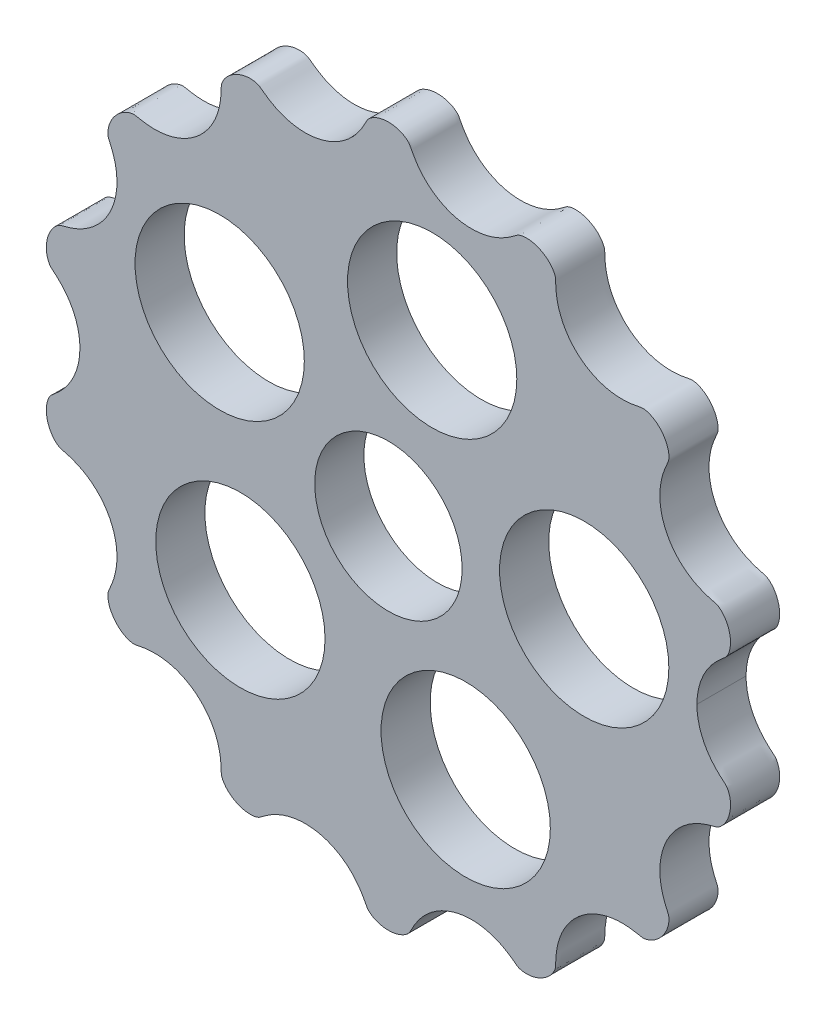
from build123d import *

# Parameters (mm, degrees)
BOSS_EXTRUDE1_DEPTH     = 5
CUT_EXTRUDE1_DEPTH      = 51.047009351
CUT_EXTRUDE1_DEPTH_BACK = 51.047009351
SKETCH2_R               = 7.5
SKETCH2_R_2             = 8.6125


with BuildPart() as part:
    # Sketch1 → Boss-Extrude1 (new body)
    with BuildSketch(Plane.XY):
        with BuildLine():
            add(Edge.make_bspline(
                [(31.387500001, 0), (31.387500026, -0.191409838), (31.4015889, -0.558999959), (31.462455208, -1.100471271), (31.620339292, -1.804284747), (31.845837979, -2.471145024), (32.138779592, -3.108930329), (32.494092859, -3.710123145), (32.85485867, -4.199914122), (33.196385391, -4.592065917), (33.481395932, -4.881104094), (33.695349877, -5.081930359), (33.873225969, -5.238846703), (34.010820911, -5.356420738), (34.126100817, -5.453563579), (34.218425357, -5.531274661), (34.321370208, -5.622243472), (34.42248528, -5.738555326), (34.526616142, -5.906653236), (34.628243434, -6.124456822), (34.743621811, -6.475137865), (34.822511835, -6.967474085), (34.811254499, -7.56440223), (34.660998274, -8.241656976), (34.42181242, -8.783732333), (34.15025528, -9.191239746), (33.902923393, -9.461924188), (33.718729162, -9.622062791), (33.539449435, -9.74564616), (33.366873711, -9.828511831), (33.18234787, -9.874959474), (33.000369496, -9.922220448), (32.78196544, -9.979321762), (32.529245694, -10.0512452), (32.243345991, -10.142503849), (31.926771107, -10.2588661), (31.537678913, -10.4222942), (31.083527423, -10.647638252), (30.574239611, -10.954067456), (30.028205463, -11.361714103), (29.524217307, -11.824126145), (29.068369731, -12.337466635), (28.670673331, -12.890470325), (28.333939537, -13.476344796), (28.059782265, -14.088772826), (27.849481201, -14.720995747), (27.703410562, -15.370288175), (27.622603934, -16.030098639), (27.607228393, -16.691306548), (27.649814276, -17.265897453), (27.72521961, -17.75248288), (27.8130852, -18.152536765), (27.898270531, -18.469924762), (27.997936462, -18.783869537), (28.11116386, -19.094030204), (28.219559393, -19.357776059), (28.31618286, -19.577676182), (28.388632047, -19.738423638), (28.434726769, -19.841332637), (28.476851504, -19.945926514), (28.5139803, -20.063213574), (28.537245609, -20.214070975), (28.545988815, -20.421106535), (28.528667796, -20.664305086), (28.479281495, -20.93847541), (28.390375736, -21.239018765), (28.236129182, -21.613261831), (27.989390246, -22.039715879), (27.629125422, -22.484235413), (27.198981399, -22.848547171), (26.794373417, -23.090233795), (26.465307873, -23.22576242), (26.233368303, -23.29274082), (26.038842986, -23.325696046), (25.885474252, -23.334363641), (25.749412223, -23.320751217), (25.631198181, -23.298729971), (25.503504803, -23.273017081), (25.365815252, -23.245742636), (25.17842045, -23.209936912), (24.861580666, -23.15540063), (24.425008243, -23.099280725), (23.866879398, -23.06737406), (23.227732011, -23.088381827), (22.593283028, -23.168329088), (21.965427998, -23.308478254), (21.350218497, -23.509248355), (20.756629467, -23.768742639), (20.190411742, -24.084901658), (19.647470301, -24.461409283), (19.135282862, -24.89801354), (18.661137869, -25.394205143), (18.233371948, -25.9476682), (17.866637437, -26.540967012), (17.563997358, -27.167132297), (17.327808384, -27.817980766), (17.179598909, -28.402901182), (17.093470388, -28.911646506), (17.050866719, -29.308158899), (17.030864745, -29.590379325), (17.020190406, -29.843097462), (17.014689565, -30.023995062), (17.011815027, -30.163298232), (17.006262447, -30.274671826), (16.99728203, -30.377172777), (16.9692524, -30.510707375), (16.901063213, -30.694922243), (16.79131022, -30.910274348), (16.586800886, -31.216765334), (16.250514568, -31.581105114), (15.776234534, -31.941308929), (15.151789594, -32.243596243), (14.5766757, -32.392171865), (14.08546615, -32.431000582), (13.71894414, -32.403056699), (13.480348036, -32.356853666), (13.294179223, -32.297748008), (13.161187597, -32.234718317), (13.056974688, -32.166085726), (12.974296484, -32.105122334), (12.871971929, -32.027775268), (12.749006525, -31.935279651), (12.577291705, -31.808567208), (12.354010571, -31.651756231), (12.025699359, -31.437867576), (11.581394178, -31.184384716), (11.040417636, -30.930285317), (10.394168199, -30.701278437), (9.725494629, -30.53787156), (8.869598237, -30.419503121), (7.847967181, -30.41972467), (6.847316751, -30.590852524), (5.900714747, -30.922312194), (5.171539786, -31.290180513), (4.619855424, -31.639804258), (4.106739862, -32.039439551), (3.636092532, -32.484307884), (3.263184555, -32.909891154), (2.973001969, -33.296991095), (2.750469117, -33.633117755), (2.604558982, -33.874823284), (2.486102146, -34.085791845), (2.394242445, -34.257795933), (2.325823796, -34.389053574), (2.261066792, -34.514691353), (2.199326494, -34.634590318), (2.12371547, -34.761953055), (2.018885858, -34.88485401), (1.87028718, -35.020455872), (1.674923004, -35.161740103), (1.434956768, -35.297359465), (1.150119762, -35.419334231), (0.769460402, -35.537430033), (0.286766304, -35.619545885), (-0.204612648, -35.625338884), (-0.690683106, -35.554699369), (-1.077585826, -35.444910287), (-1.368129192, -35.329321198), (-1.613869484, -35.198992053), (-1.816088644, -35.062763588), (-1.970779193, -34.931010646), (-2.084032621, -34.813065531), (-2.159333408, -34.703851232), (-2.20905324, -34.614659613), (-2.256431386, -34.524252201), (-2.305956612, -34.427505552), (-2.366847605, -34.30999054), (-2.4587882, -34.13598509), (-2.576984294, -33.922308749), (-2.722647994, -33.67740764), (-2.945018955, -33.336509028), (-3.235549855, -32.943659747), (-3.609341716, -32.511914186), (-4.081749968, -32.060730677), (-4.597449485, -31.655389431), (-5.152453816, -31.300775561), (-5.887288163, -30.927417187), (-6.839439977, -30.59230849), (-7.844773855, -30.419725507), (-8.869598364, -30.419502966), (-9.725494876, -30.537871549), (-10.394168372, -30.70127833), (-11.040417864, -30.93028527), (-11.58139437, -31.184384621), (-12.025699577, -31.437867507), (-12.354010777, -31.651756143), (-12.57729192, -31.808567128), (-12.749006736, -31.935279565), (-12.871972142, -32.027775183), (-12.974296698, -32.105122247), (-13.056974901, -32.16608564), (-13.161187811, -32.23471823), (-13.294179437, -32.29774792), (-13.480348251, -32.356853576), (-13.718944355, -32.403056607), (-14.085466365, -32.431000489), (-14.576675916, -32.392171768), (-15.151789808, -32.243596142), (-15.776234746, -31.941308824), (-16.250514778, -31.581105006), (-16.586801094, -31.216765224), (-16.791310426, -30.910274237), (-16.901063417, -30.694922131), (-16.969252603, -30.510707262), (-16.997282232, -30.377172664), (-17.006262648, -30.274671713), (-17.011815228, -30.163298119), (-17.014689764, -30.023994949), (-17.020190605, -29.843097349), (-17.030864942, -29.590379211), (-17.050866914, -29.308158787), (-17.09347058, -28.911646391), (-17.179599098, -28.40290107), (-17.327808569, -27.817980647), (-17.563997539, -27.167132186), (-17.866637613, -26.540966885), (-18.23337212, -25.947668091), (-18.661138039, -25.394204998), (-19.135283025, -24.898013447), (-19.647470468, -24.461409096), (-20.190411896, -24.084901617), (-20.756629635, -23.768742344), (-21.350218637, -23.509248474), (-21.96542818, -23.308477669), (-22.593283134, -23.16832969), (-23.227732251, -23.088380303), (-23.866879784, -23.067372181), (-24.425008298, -23.0992813), (-24.861580739, -23.155401751), (-25.17842063, -23.209936331), (-25.365815398, -23.2457426), (-25.503504959, -23.273016895), (-25.631198336, -23.298729796), (-25.749412378, -23.320751047), (-25.885474407, -23.334363469), (-26.038843141, -23.325695873), (-26.233368458, -23.292740646), (-26.465308027, -23.225762244), (-26.794373571, -23.090233617), (-27.198981551, -22.84854699), (-27.629125571, -22.484235229), (-27.989390393, -22.039715693), (-28.236129326, -21.613261644), (-28.390375878, -21.239018577), (-28.479281634, -20.93847522), (-28.528667934, -20.664304896), (-28.545988951, -20.421106346), (-28.537245744, -20.214070785), (-28.513980433, -20.063213384), (-28.476851636, -19.945926324), (-28.4347269, -19.841332448), (-28.388632178, -19.73842345), (-28.31618299, -19.577675994), (-28.219559522, -19.357775871), (-28.111163987, -19.094030017), (-27.997936587, -18.783869351), (-27.898270653, -18.469924576), (-27.813085321, -18.15253658), (-27.725219728, -17.752482696), (-27.649814391, -17.265897269), (-27.607228504, -16.691306364), (-27.62260404, -16.030098455), (-27.703410664, -15.370287991), (-27.849481299, -14.720995562), (-28.059782359, -14.088772639), (-28.333939626, -13.476344608), (-28.670673417, -12.890470134), (-29.068369813, -12.337466442), (-29.524217386, -11.824125949), (-30.028205539, -11.361713904), (-30.574239684, -10.954067253), (-31.083527494, -10.647638045), (-31.537678982, -10.42229399), (-31.926771175, -10.258865888), (-32.243346059, -10.142503635), (-32.529245761, -10.051244984), (-32.781965507, -9.979321544), (-33.000369562, -9.922220228), (-33.182347935, -9.874959254), (-33.366873776, -9.828511609), (-33.5394495, -9.745645937), (-33.718729226, -9.622062567), (-33.902923455, -9.461923963), (-34.150255341, -9.191239519), (-34.421812479, -8.783732104), (-34.660998329, -8.241656745), (-34.81125455, -7.564401999), (-34.822511882, -6.967473853), (-34.743621854, -6.475137634), (-34.628243474, -6.124456592), (-34.526616181, -5.906653006), (-34.422485319, -5.738555098), (-34.321370245, -5.622243244), (-34.218425394, -5.531274433), (-34.126100854, -5.453563352), (-34.010820946, -5.356420512), (-33.873226004, -5.238846477), (-33.695349911, -5.081930135), (-33.481395964, -4.881103871), (-33.196385422, -4.592065696), (-32.854858698, -4.199913904), (-32.494092884, -3.710122929), (-32.138779613, -3.108930115), (-31.845837996, -2.471144813), (-31.558911714, -1.622626634), (-31.427525083, -0.911371145), (-31.387500063, -0.367589804), (-31.387500001, 0)],
                knots=[0.103459311, 0.103459311, 0.103459311, 0.103459311, 0.103459311, 0.108282381, 0.112721697, 0.117161213, 0.121600728, 0.125987713, 0.130374698, 0.13472717, 0.136903406, 0.139079642, 0.14059969, 0.142119739, 0.142879763, 0.143639788, 0.144399812, 0.145159837, 0.146335778, 0.147511719, 0.149360116, 0.151208513, 0.155610339, 0.160013805, 0.164294975, 0.168579928, 0.170438328, 0.172296728, 0.173508946, 0.174721165, 0.175908015, 0.177094865, 0.178281716, 0.179468566, 0.181592661, 0.183716756, 0.185840851, 0.187964946, 0.192222657, 0.196480367, 0.200793288, 0.20510621, 0.209427538, 0.213748866, 0.217926621, 0.222104375, 0.22630704, 0.230509705, 0.23466829, 0.238826875, 0.242945784, 0.245005239, 0.247064694, 0.249143974, 0.251223255, 0.253302535, 0.255381816, 0.256328153, 0.25727449, 0.257747659, 0.258220828, 0.259167165, 0.260371245, 0.261575325, 0.263435854, 0.265296383, 0.267377025, 0.269457666, 0.273617251, 0.277665028, 0.281712441, 0.283576659, 0.285440877, 0.286611911, 0.287782945, 0.288539492, 0.289296038, 0.290052585, 0.290809131, 0.291821706, 0.29283428, 0.294859428, 0.298909724, 0.302906114, 0.306902505, 0.310950904, 0.314999303, 0.319091512, 0.323183722, 0.327249058, 0.331314394, 0.335713939, 0.340113485, 0.344510805, 0.348908126, 0.353257429, 0.357606733, 0.361927473, 0.364087843, 0.366248213, 0.367652094, 0.369055974, 0.370459854, 0.370810824, 0.371161794, 0.371863734, 0.373051087, 0.37423844, 0.376092101, 0.377945762, 0.382308889, 0.386671268, 0.390992848, 0.395317569, 0.397172902, 0.399028234, 0.400230037, 0.40143184, 0.402078268, 0.402724696, 0.403371125, 0.404017553, 0.405310409, 0.406603265, 0.408747638, 0.41089201, 0.415180756, 0.419482319, 0.423783882, 0.428139722, 0.432495561, 0.44121588, 0.449419283, 0.453546476, 0.457673669, 0.461762281, 0.465850894, 0.469909329, 0.473967765, 0.475999805, 0.478031845, 0.480063885, 0.481079905, 0.482095925, 0.482944924, 0.483793923, 0.484642922, 0.48549192, 0.486669259, 0.487846597, 0.489700948, 0.491555299, 0.493597948, 0.495640598, 0.499725294, 0.503848229, 0.505910078, 0.507971927, 0.50984196, 0.511711993, 0.512906303, 0.514100613, 0.514957378, 0.515814142, 0.516242525, 0.516670907, 0.517527672, 0.518553103, 0.519578534, 0.521629396, 0.523680258, 0.52573112, 0.529831328, 0.533931536, 0.538048962, 0.542166388, 0.546333484, 0.55050058, 0.55878412, 0.567504439, 0.571860278, 0.576216118, 0.580517681, 0.584819244, 0.58910799, 0.591252362, 0.593396735, 0.594689591, 0.595982447, 0.596628875, 0.597275304, 0.597921732, 0.59856816, 0.599769963, 0.600971766, 0.602827098, 0.604682431, 0.609007152, 0.613328732, 0.617691111, 0.622054238, 0.623907899, 0.62576156, 0.626948913, 0.628136266, 0.628838206, 0.629189176, 0.629540146, 0.630944026, 0.632347906, 0.633751787, 0.635912157, 0.638072527, 0.642393267, 0.646742571, 0.651091874, 0.655489195, 0.659886515, 0.664286061, 0.668685606, 0.672750942, 0.676816278, 0.680908488, 0.685000697, 0.689049096, 0.693097495, 0.697093886, 0.701090276, 0.705140572, 0.70716572, 0.708178294, 0.709190869, 0.709947415, 0.710703962, 0.711460508, 0.712217055, 0.713388089, 0.714559123, 0.716423341, 0.718287559, 0.722334972, 0.726382749, 0.730542334, 0.732622975, 0.734703617, 0.736564146, 0.738424675, 0.739628755, 0.740832835, 0.741779172, 0.742252341, 0.74272551, 0.743671847, 0.744618184, 0.746697465, 0.748776745, 0.750856026, 0.752935306, 0.754994761, 0.757054216, 0.761173125, 0.76533171, 0.769490295, 0.77369296, 0.777895625, 0.782073379, 0.786251134, 0.790572462, 0.79489379, 0.799206712, 0.803519633, 0.807777343, 0.812035054, 0.814159149, 0.816283244, 0.818407339, 0.820531434, 0.821718284, 0.822905135, 0.824091985, 0.825278835, 0.826491054, 0.827703272, 0.829561672, 0.831420072, 0.835705025, 0.839986195, 0.844389661, 0.848791487, 0.850639884, 0.852488281, 0.853664222, 0.854840163, 0.855600188, 0.856360212, 0.857120237, 0.857880261, 0.85940031, 0.860920358, 0.863096594, 0.86527283, 0.869625302, 0.874012287, 0.878399272, 0.882838787, 0.887278303, 0.896540688, 0.896540688, 0.896540688, 0.896540688, 0.896540688], degree=4))
            add(Edge.make_bspline(
                [(31.387500001, 0), (31.387500027, 0.191409839), (31.401588902, 0.55899996), (31.462455211, 1.100471272), (31.620339298, 1.804284749), (31.845837987, 2.471145025), (32.138779603, 3.108930328), (32.494092872, 3.710123144), (32.854858684, 4.19991412), (33.196385406, 4.592065913), (33.481395948, 4.881104089), (33.695349894, 5.081930353), (33.873225987, 5.238846696), (34.010820929, 5.356420732), (34.126100836, 5.453563572), (34.218425375, 5.531274654), (34.321370227, 5.622243465), (34.4224853, 5.738555318), (34.526616162, 5.906653227), (34.628243454, 6.124456814), (34.743621832, 6.475137856), (34.822511859, 6.967474076), (34.811254524, 7.564402221), (34.660998301, 8.241656967), (34.421812449, 8.783732325), (34.150255311, 9.191239739), (33.902923424, 9.461924182), (33.718729194, 9.622062786), (33.539449468, 9.745646155), (33.366873744, 9.828511827), (33.182347902, 9.87495947), (33.000369529, 9.922220445), (32.781965474, 9.97932176), (32.529245727, 10.051245199), (32.243346025, 10.142503849), (31.926771141, 10.258866101), (31.537678948, 10.422294202), (31.083527459, 10.647638255), (30.574239647, 10.954067461), (30.028205501, 11.36171411), (29.524217346, 11.824126153), (29.068369772, 12.337466645), (28.670673374, 12.890470336), (28.333939582, 13.476344808), (28.059782312, 14.088772839), (27.84948125, 14.720995761), (27.703410613, 15.37028819), (27.622603987, 16.030098654), (27.607228449, 16.691306562), (27.649814333, 17.265897467), (27.725219669, 17.752482895), (27.81308526, 18.152536779), (27.898270592, 18.469924776), (27.997936524, 18.78386955), (28.111163924, 19.094030217), (28.219559458, 19.357776071), (28.316182925, 19.577676195), (28.388632113, 19.73842365), (28.434726835, 19.841332649), (28.47685157, 19.945926526), (28.513980367, 20.063213586), (28.537245677, 20.214070986), (28.545988883, 20.421106547), (28.528667865, 20.664305097), (28.479281565, 20.938475422), (28.390375807, 21.239018777), (28.236129254, 21.613261844), (27.989390319, 22.039715892), (27.629125497, 22.484235428), (27.198981475, 22.848547187), (26.794373494, 23.090233813), (26.46530795, 23.225762438), (26.233368381, 23.292740839), (26.038843063, 23.325696066), (25.88547433, 23.334363661), (25.749412301, 23.320751238), (25.631198258, 23.298729992), (25.50350488, 23.273017103), (25.365815329, 23.245742659), (25.178420527, 23.209936935), (24.861580743, 23.155400654), (24.42500832, 23.09928075), (23.866879475, 23.067374088), (23.227732087, 23.088381856), (22.593283105, 23.16832912), (21.965428075, 23.308478287), (21.350218575, 23.509248391), (20.756629546, 23.768742677), (20.190411822, 24.084901697), (19.647470383, 24.461409324), (19.135282945, 24.898013583), (18.661137953, 25.394205187), (18.233372034, 25.947668245), (17.866637525, 26.540967059), (17.563997449, 27.167132345), (17.327808476, 27.817980815), (17.179599003, 28.402901231), (17.093470484, 28.911646556), (17.050866817, 29.308158949), (17.030864843, 29.590379375), (17.020190505, 29.843097512), (17.014689665, 30.023995112), (17.011815128, 30.163298282), (17.006262548, 30.274671876), (16.997282131, 30.377172827), (16.969252501, 30.510707425), (16.901063315, 30.694922293), (16.791310323, 30.910274399), (16.58680099, 31.216765385), (16.250514673, 31.581105167), (15.77623464, 31.941308983), (15.151789701, 32.243596299), (14.576675808, 32.392171923), (14.085466258, 32.431000642), (13.718944248, 32.40305676), (13.480348143, 32.356853728), (13.29417933, 32.29774807), (13.161187704, 32.23471838), (13.056974794, 32.166085789), (12.974296591, 32.105122397), (12.871972035, 32.027775332), (12.749006631, 31.935279715), (12.577291811, 31.808567273), (12.354010677, 31.651756297), (12.025699463, 31.437867643), (11.581394281, 31.184384784), (11.040417739, 30.930285386), (10.394168301, 30.701278509), (9.72549473, 30.537871634), (8.869598338, 30.419503198), (7.847967282, 30.41972475), (6.847316852, 30.590852607), (5.90071485, 30.922312281), (5.17153989, 31.290180602), (4.619855529, 31.63980435), (4.106739969, 32.039439644), (3.63609264, 32.484307979), (3.263184664, 32.90989125), (2.97300208, 33.296991192), (2.750469229, 33.633117853), (2.604559095, 33.874823381), (2.486102259, 34.085791943), (2.394242559, 34.257796032), (2.325823911, 34.389053673), (2.261066906, 34.514691452), (2.199326609, 34.634590417), (2.123715586, 34.761953154), (2.018885974, 34.884854109), (1.870287297, 35.020455973), (1.674923121, 35.161740204), (1.434956885, 35.297359566), (1.150119879, 35.419334334), (0.76946052, 35.537430137), (0.286766422, 35.61954599), (-0.204612529, 35.625338991), (-0.690682987, 35.554699478), (-1.077585708, 35.444910397), (-1.368129075, 35.329321309), (-1.613869367, 35.198992165), (-1.816088528, 35.062763701), (-1.970779077, 34.931010759), (-2.084032505, 34.813065645), (-2.159333292, 34.703851346), (-2.209053124, 34.614659727), (-2.256431271, 34.524252315), (-2.305956498, 34.427505666), (-2.366847491, 34.309990654), (-2.458788086, 34.135985204), (-2.576984181, 33.922308864), (-2.722647882, 33.677407756), (-2.945018844, 33.336509144), (-3.235549745, 32.943659864), (-3.609341608, 32.511914305), (-4.081749861, 32.060730797), (-4.59744938, 31.655389553), (-5.152453712, 31.300775684), (-5.88728806, 30.927417313), (-6.839439876, 30.592308619), (-7.844773754, 30.41972564), (-8.869598262, 30.419503102), (-9.725494775, 30.537871688), (-10.39416827, 30.701278471), (-11.040417762, 30.930285413), (-11.581394266, 31.184384766), (-12.025699472, 31.437867654), (-12.354010671, 31.651756291), (-12.577291814, 31.808567276), (-12.74900663, 31.935279713), (-12.871972035, 32.027775332), (-12.974296591, 32.105122397), (-13.056974794, 32.166085789), (-13.161187704, 32.23471838), (-13.29417933, 32.29774807), (-13.480348143, 32.356853728), (-13.718944248, 32.40305676), (-14.085466257, 32.431000642), (-14.576675808, 32.392171923), (-15.151789701, 32.243596299), (-15.77623464, 31.941308983), (-16.250514673, 31.581105167), (-16.58680099, 31.216765385), (-16.791310323, 30.910274399), (-16.901063315, 30.694922293), (-16.969252501, 30.510707425), (-16.997282131, 30.377172827), (-17.006262548, 30.274671876), (-17.011815128, 30.163298282), (-17.014689665, 30.023995112), (-17.020190505, 29.843097512), (-17.030864843, 29.590379374), (-17.050866817, 29.30815895), (-17.093470484, 28.911646554), (-17.179599003, 28.402901233), (-17.327808477, 27.817980811), (-17.563997448, 27.167132351), (-17.866637525, 26.540967051), (-18.233372033, 25.947668258), (-18.661137954, 25.394205166), (-19.135282942, 24.898013617), (-19.647470386, 24.461409268), (-20.190411816, 24.08490179), (-20.756629556, 23.768742519), (-21.350218558, 23.509248651), (-21.965428103, 23.308477849), (-22.593283057, 23.168329871), (-23.227732174, 23.088380486), (-23.866879707, 23.067372367), (-24.425008221, 23.099281487), (-24.861580662, 23.15540194), (-25.178420553, 23.209936521), (-25.365815321, 23.245742791), (-25.503504881, 23.273017086), (-25.631198259, 23.298729988), (-25.749412301, 23.320751239), (-25.88547433, 23.334363662), (-26.038843063, 23.325696066), (-26.233368381, 23.29274084), (-26.46530795, 23.225762438), (-26.794373494, 23.090233813), (-27.198981475, 22.848547187), (-27.629125497, 22.484235428), (-27.989390319, 22.039715892), (-28.236129254, 21.613261844), (-28.390375807, 21.239018777), (-28.479281565, 20.938475422), (-28.528667865, 20.664305097), (-28.545988883, 20.421106547), (-28.537245677, 20.214070986), (-28.513980367, 20.063213586), (-28.47685157, 19.945926526), (-28.434726834, 19.841332649), (-28.388632113, 19.73842365), (-28.316182925, 19.577676195), (-28.219559458, 19.357776071), (-28.111163924, 19.094030217), (-27.997936524, 18.783869551), (-27.898270592, 18.469924776), (-27.81308526, 18.152536779), (-27.725219669, 17.752482895), (-27.649814333, 17.265897467), (-27.607228449, 16.691306562), (-27.622603987, 16.030098654), (-27.703410613, 15.37028819), (-27.84948125, 14.720995761), (-28.059782312, 14.088772839), (-28.333939582, 13.476344808), (-28.670673374, 12.890470336), (-29.068369772, 12.337466645), (-29.524217346, 11.824126153), (-30.028205501, 11.36171411), (-30.574239647, 10.954067461), (-31.083527459, 10.647638255), (-31.537678948, 10.422294202), (-31.926771141, 10.258866101), (-32.243346025, 10.142503849), (-32.529245727, 10.051245199), (-32.781965474, 9.97932176), (-33.000369529, 9.922220445), (-33.182347902, 9.87495947), (-33.366873744, 9.828511827), (-33.539449468, 9.745646155), (-33.718729194, 9.622062786), (-33.902923424, 9.461924182), (-34.150255311, 9.191239739), (-34.421812449, 8.783732325), (-34.660998301, 8.241656967), (-34.811254524, 7.564402221), (-34.822511859, 6.967474076), (-34.743621832, 6.475137856), (-34.628243454, 6.124456814), (-34.526616162, 5.906653227), (-34.4224853, 5.738555319), (-34.321370227, 5.622243465), (-34.218425375, 5.531274654), (-34.126100835, 5.453563572), (-34.010820929, 5.356420732), (-33.873225987, 5.238846697), (-33.695349894, 5.081930353), (-33.481395948, 4.881104089), (-33.196385406, 4.592065913), (-32.854858684, 4.19991412), (-32.494092872, 3.710123144), (-32.138779603, 3.108930329), (-31.845837987, 2.471145025), (-31.558911692, 1.622626795), (-31.427525061, 0.911371252), (-31.38750005, 0.367589857), (-31.387500001, 0)],
                knots=[0.103459311, 0.103459311, 0.103459311, 0.103459311, 0.103459311, 0.108282381, 0.112721697, 0.117161213, 0.121600728, 0.125987713, 0.130374698, 0.13472717, 0.136903406, 0.139079642, 0.14059969, 0.142119739, 0.142879763, 0.143639788, 0.144399812, 0.145159837, 0.146335778, 0.147511719, 0.149360116, 0.151208513, 0.155610339, 0.160013805, 0.164294975, 0.168579928, 0.170438328, 0.172296728, 0.173508946, 0.174721165, 0.175908015, 0.177094865, 0.178281716, 0.179468566, 0.181592661, 0.183716756, 0.185840851, 0.187964946, 0.192222657, 0.196480367, 0.200793288, 0.20510621, 0.209427538, 0.213748866, 0.217926621, 0.222104375, 0.22630704, 0.230509705, 0.23466829, 0.238826875, 0.242945784, 0.245005239, 0.247064694, 0.249143974, 0.251223255, 0.253302535, 0.255381816, 0.256328153, 0.25727449, 0.257747659, 0.258220828, 0.259167165, 0.260371245, 0.261575325, 0.263435854, 0.265296383, 0.267377025, 0.269457666, 0.273617251, 0.277665028, 0.281712441, 0.283576659, 0.285440877, 0.286611911, 0.287782945, 0.288539492, 0.289296038, 0.290052585, 0.290809131, 0.291821706, 0.29283428, 0.294859428, 0.298909724, 0.302906114, 0.306902505, 0.310950904, 0.314999303, 0.319091512, 0.323183722, 0.327249058, 0.331314394, 0.335713939, 0.340113485, 0.344510805, 0.348908126, 0.353257429, 0.357606733, 0.361927473, 0.364087843, 0.366248213, 0.367652094, 0.369055974, 0.370459854, 0.370810824, 0.371161794, 0.371863734, 0.373051087, 0.37423844, 0.376092101, 0.377945762, 0.382308889, 0.386671268, 0.390992848, 0.395317569, 0.397172902, 0.399028234, 0.400230037, 0.40143184, 0.402078268, 0.402724696, 0.403371125, 0.404017553, 0.405310409, 0.406603265, 0.408747638, 0.41089201, 0.415180756, 0.419482319, 0.423783882, 0.428139722, 0.432495561, 0.44121588, 0.449419283, 0.453546476, 0.457673669, 0.461762281, 0.465850894, 0.469909329, 0.473967765, 0.475999805, 0.478031845, 0.480063885, 0.481079905, 0.482095925, 0.482944924, 0.483793923, 0.484642922, 0.48549192, 0.486669259, 0.487846597, 0.489700948, 0.491555299, 0.493597948, 0.495640598, 0.499725294, 0.503848229, 0.505910078, 0.507971927, 0.50984196, 0.511711993, 0.512906303, 0.514100613, 0.514957378, 0.515814142, 0.516242525, 0.516670907, 0.517527672, 0.518553103, 0.519578534, 0.521629396, 0.523680258, 0.52573112, 0.529831328, 0.533931536, 0.538048962, 0.542166388, 0.546333484, 0.55050058, 0.55878412, 0.567504439, 0.571860278, 0.576216118, 0.580517681, 0.584819244, 0.58910799, 0.591252362, 0.593396735, 0.594689591, 0.595982447, 0.596628875, 0.597275304, 0.597921732, 0.59856816, 0.599769963, 0.600971766, 0.602827098, 0.604682431, 0.609007152, 0.613328732, 0.617691111, 0.622054238, 0.623907899, 0.62576156, 0.626948913, 0.628136266, 0.628838206, 0.629189176, 0.629540146, 0.630944026, 0.632347906, 0.633751787, 0.635912157, 0.638072527, 0.642393267, 0.646742571, 0.651091874, 0.655489195, 0.659886515, 0.664286061, 0.668685606, 0.672750942, 0.676816278, 0.680908488, 0.685000697, 0.689049096, 0.693097495, 0.697093886, 0.701090276, 0.705140572, 0.70716572, 0.708178294, 0.709190869, 0.709947415, 0.710703962, 0.711460508, 0.712217055, 0.713388089, 0.714559123, 0.716423341, 0.718287559, 0.722334972, 0.726382749, 0.730542334, 0.732622975, 0.734703617, 0.736564146, 0.738424675, 0.739628755, 0.740832835, 0.741779172, 0.742252341, 0.74272551, 0.743671847, 0.744618184, 0.746697465, 0.748776745, 0.750856026, 0.752935306, 0.754994761, 0.757054216, 0.761173125, 0.76533171, 0.769490295, 0.77369296, 0.777895625, 0.782073379, 0.786251134, 0.790572462, 0.79489379, 0.799206712, 0.803519633, 0.807777343, 0.812035054, 0.814159149, 0.816283244, 0.818407339, 0.820531434, 0.821718284, 0.822905135, 0.824091985, 0.825278835, 0.826491054, 0.827703272, 0.829561672, 0.831420072, 0.835705025, 0.839986195, 0.844389661, 0.848791487, 0.850639884, 0.852488281, 0.853664222, 0.854840163, 0.855600188, 0.856360212, 0.857120237, 0.857880261, 0.85940031, 0.860920358, 0.863096594, 0.86527283, 0.869625302, 0.874012287, 0.878399272, 0.882838787, 0.887278303, 0.896540689, 0.896540689, 0.896540689, 0.896540689, 0.896540689], degree=4))
        make_face()
    extrude(amount=BOSS_EXTRUDE1_DEPTH)

    # Sketch2 → Cut-Extrude1 (cut, two sides: drawn at the far end of the back side and taken through both)
    with BuildSketch(Plane.XY.offset(5).offset(-CUT_EXTRUDE1_DEPTH_BACK)):
        Circle(SKETCH2_R)
        with Locations((4.450418679, 19.498558244)):
            Circle(SKETCH2_R_2)
        with Locations((19.91948588, 1.792786178)):
            Circle(SKETCH2_R_2)
        with Locations((7.860500633, -18.390555451)):
            Circle(SKETCH2_R_2)
        with Locations((-15.06142932, -13.158774519)):
            Circle(SKETCH2_R_2)
        with Locations((-17.168975872, 10.257985548)):
            Circle(SKETCH2_R_2)
    extrude(amount=CUT_EXTRUDE1_DEPTH + CUT_EXTRUDE1_DEPTH_BACK, mode=Mode.SUBTRACT)


solid = part.part
